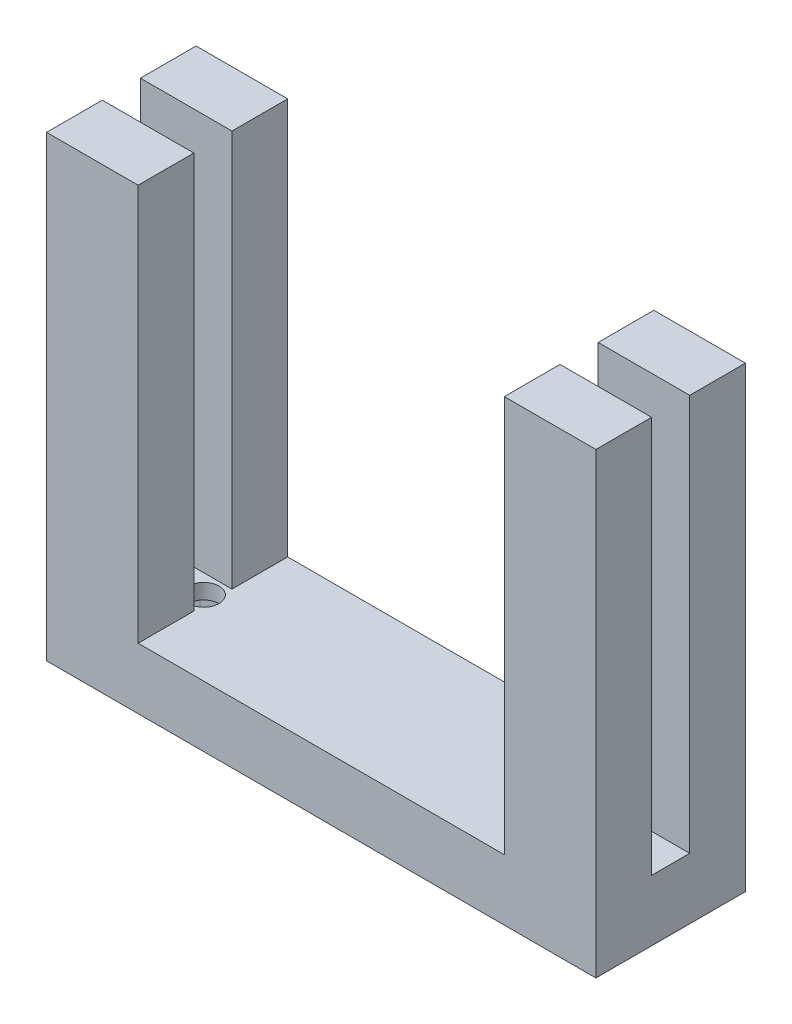
from build123d import *

# Parameters (mm, degrees)
SKETCH_1_W          = 36
SKETCH_1_H          = 9.8
EXTRUDE_1_DEPTH     = 30
SKETCH_2_W          = 2.5
SKETCH_2_H          = 26
CUT_EXTRUDE_1_DEPTH = 48.116982077
SKETCH_3_W          = 24
SKETCH_3_H          = 26
CUT_EXTRUDE_2_DEPTH = 37.332354727
CUT_EXTRUDE_3_DEPTH = 3
CUT_EXTRUDE_4_REACH = 34.818
SKETCH_9_R          = 1


with BuildPart() as part:
    # 草图1 → 凸台-拉伸1 (new body)
    with BuildSketch(Plane(origin=(0, 0, 0), x_dir=(1, 0, 0), z_dir=(0, 1, 0))):
        Rectangle(SKETCH_1_W, SKETCH_1_H)
    extrude(amount=EXTRUDE_1_DEPTH)

    # 草图2 → 切除-拉伸1 (cut, through all)
    with BuildSketch(Plane(origin=(18, 0, 0), x_dir=(0, 0, -1), z_dir=(1, 0, 0))):
        with Locations((0, 17)):
            Rectangle(SKETCH_2_W, SKETCH_2_H)
    extrude(amount=-CUT_EXTRUDE_1_DEPTH, mode=Mode.SUBTRACT)

    # 草图3 → 切除-拉伸2 (cut, through all)
    with BuildSketch(Plane(origin=(0, 0, -4.9), x_dir=(-1, 0, 0), z_dir=(0, 0, -1))):
        with Locations((0, 17)):
            Rectangle(SKETCH_3_W, SKETCH_3_H)
    extrude(amount=-CUT_EXTRUDE_2_DEPTH, mode=Mode.SUBTRACT)

    # 草图5 → 切除-拉伸3 (cut)
    with BuildSketch(Plane.XZ):
        with BuildLine():
            Line((14.966101695, 2.113983221), (0.368644068, 3.606206671))
            ThreePointArc((0.368644068, 3.606206671), (0, 3.625), (-0.368644068, 3.606206671))
            Line((-0.368644068, 3.606206671), (-14.966101695, 2.113983221))
            ThreePointArc((-14.966101695, 2.113983221), (-16.875, 0), (-14.966101695, -2.113983221))
            Line((-14.966101695, -2.113983221), (-0.368644068, -3.606206671))
            ThreePointArc((-0.368644068, -3.606206671), (0, -3.625), (0.368644068, -3.606206671))
            Line((0.368644068, -3.606206671), (14.966101695, -2.113983221))
            ThreePointArc((14.966101695, -2.113983221), (16.875, 0), (14.966101695, 2.113983221))
        make_face()
    extrude(amount=-CUT_EXTRUDE_3_DEPTH, mode=Mode.SUBTRACT)

    # 草图9 → 切除-拉伸4 (cut, up to next)
    with BuildSketch(Plane.XZ.offset(-3), mode=Mode.PRIVATE) as cut_extrude_4_sk1:
        with Locations(Location((12.6, 0, 0), (0, 0, 270))):
            Circle(SKETCH_9_R)
    cut_extrude_4_tool1 = extrude(cut_extrude_4_sk1.sketch, amount=-CUT_EXTRUDE_4_REACH, mode=Mode.PRIVATE) & part.part
    # 草图9 → 切除-拉伸4 (cut, up to next)
    with BuildSketch(Plane.XZ.offset(-3), mode=Mode.PRIVATE) as cut_extrude_4_sk2:
        with Locations(Location((-12.6, 0, 0), (0, 0, 270))):
            Circle(SKETCH_9_R)
    cut_extrude_4_tool2 = extrude(cut_extrude_4_sk2.sketch, amount=-CUT_EXTRUDE_4_REACH, mode=Mode.PRIVATE) & part.part
    add(cut_extrude_4_tool1.solids().sort_by_distance((12.6, 3, 0))[0], mode=Mode.SUBTRACT)
    add(cut_extrude_4_tool2.solids().sort_by_distance((-12.6, 3, 0))[0], mode=Mode.SUBTRACT)


solid = part.part
